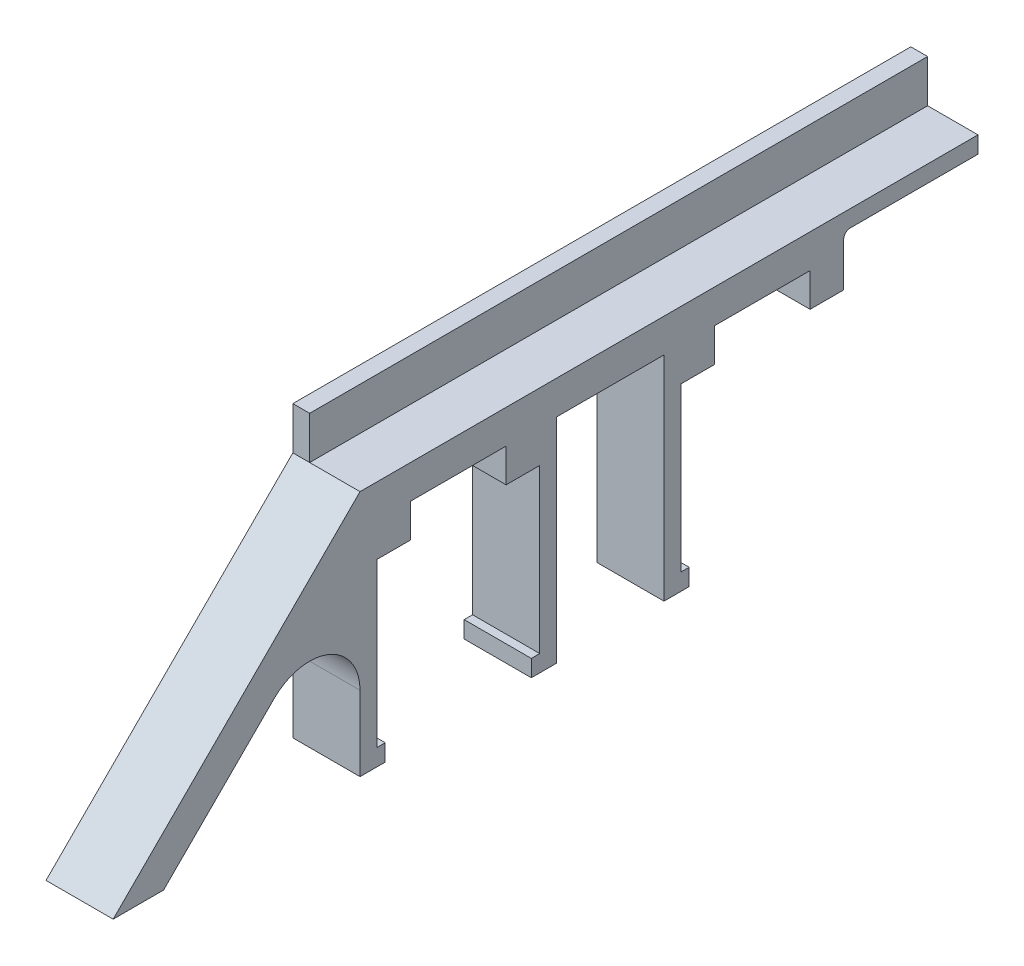
from build123d import *

# Parameters (mm, degrees)
SKETCH1_W           = 5
SKETCH1_H           = 5
SKETCH1_W_2         = 35
BOSS_EXTRUDE2_DEPTH = 20
FILLET1_R           = 15
FILLET2_R           = 2
BOSS_EXTRUDE3_DEPTH = 12.7


with BuildPart() as part:
    # Sketch1 → Boss-Extrude2 (new body)
    with BuildSketch(Plane(origin=(0, 0, 0), x_dir=(0, 0, -1), z_dir=(1, 0, 0))):
        Polygon((-5, 53.5), (-5, 68.5), (-78.5, -5), (-63.5, -5), align=None)
        Polygon((69.5, 68.5), (-5, 68.5), (-5, 53.5), (-5, -5), (2.5, -5), (2.5, 0), (0, 0), (0, 48.5), (10, 48.5), (10, 58.5), (38.5, 58.5), (38.5, 48.5), (48.5, 48.5), (48.5, 0), (53.5, 0), (53.5, 58.5), (69.5, 58.5), align=None)
        Polygon((139, 68.5), (69.5, 68.5), (69.5, 58.5), (85.5, 58.5), (85.5, 0), (90.5, 0), (90.5, 48.5), (100.5, 48.5), (100.5, 58.5), (129, 58.5), (129, 48.5), (139, 48.5), (139, 63.5), align=None)
        Polygon((90.5, 0), (93, 0), (93, -5), (85.5, -5), (85.5, 0), align=None)
        Polygon((53.5, -5), (46, -5), (46, 0), (48.5, 0), (53.5, 0), align=None)
        with Locations((141.5, 66)):
            Rectangle(SKETCH1_W, SKETCH1_H)
        with Locations((161.5, 66)):
            Rectangle(SKETCH1_W_2, SKETCH1_H)
    extrude(amount=BOSS_EXTRUDE2_DEPTH)

    # Fillet1
    fillet1_edges = [part.edges().sort_by_distance(p)[0] for p in [
        (10, 53.5, 5),
    ]]
    fillet(fillet1_edges, radius=FILLET1_R)

    # Fillet2
    fillet2_edges = [part.edges().sort_by_distance(p)[0] for p in [
        (10, 63.5, -139),
    ]]
    fillet(fillet2_edges, radius=FILLET2_R)

    # Sketch2 → Boss-Extrude3 (add)
    with BuildSketch(Plane(origin=(0, 68.5, 0), x_dir=(1, 0, 0), z_dir=(0, 1, 0))):
        Polygon((5, 35), (5, 179), (0, 179), (0, -5), (5, -5), align=None)
    extrude(amount=BOSS_EXTRUDE3_DEPTH)


solid = part.part
